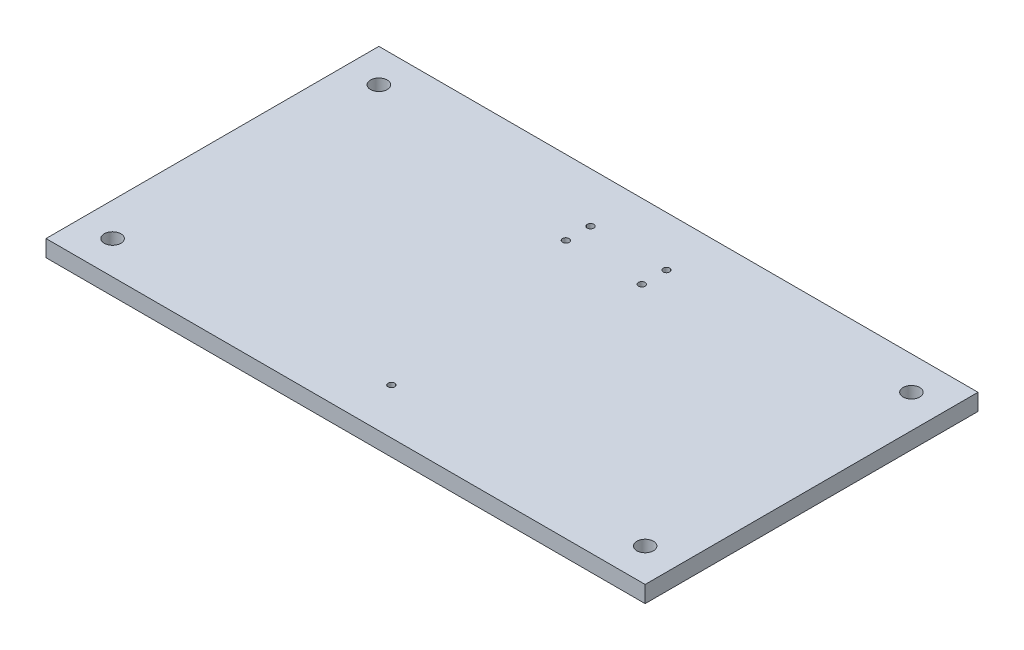
from build123d import *

# Parameters (mm, degrees)
SKETCH1_W           = 228.6
SKETCH1_H           = 127
SKETCH1_R           = 1.27
SKETCH1_R_2         = 3.175
BOSS_EXTRUDE1_DEPTH = 6.35


with BuildPart() as part:
    # Sketch1 → Boss-Extrude1 (new body)
    with BuildSketch(Plane(origin=(0, 0, 0), x_dir=(1, 0, 0), z_dir=(0, 1, 0))):
        with Locations((76.2, -6.35)):
            Rectangle(SKETCH1_W, SKETCH1_H)
        with Locations(Location((61.71311, 38.1, 0), (0, 0, 270))):
            Circle(SKETCH1_R, mode=Mode.SUBTRACT)
        with Locations(Location((90.68689, 38.1, 0), (0, 0, 270))):
            Circle(SKETCH1_R, mode=Mode.SUBTRACT)
        with Locations(Location((76.2, -52.35956, 0), (0, 0, 270))):
            Circle(SKETCH1_R, mode=Mode.SUBTRACT)
        with Locations(Location((61.71311, 28.69946, 0), (0, 0, 270))):
            Circle(SKETCH1_R, mode=Mode.SUBTRACT)
        with Locations(Location((90.68689, 28.69946, 0), (0, 0, 270))):
            Circle(SKETCH1_R, mode=Mode.SUBTRACT)
        with Locations(Location((-25.4, 44.45, 0), (0, 0, 270))):
            Circle(SKETCH1_R_2, mode=Mode.SUBTRACT)
        with Locations(Location((177.8, 44.45, 0), (0, 0, 270))):
            Circle(SKETCH1_R_2, mode=Mode.SUBTRACT)
        with Locations(Location((177.8, -57.15, 0), (0, 0, 270))):
            Circle(SKETCH1_R_2, mode=Mode.SUBTRACT)
        with Locations(Location((-25.4, -57.15, 0), (0, 0, 270))):
            Circle(SKETCH1_R_2, mode=Mode.SUBTRACT)
    extrude(amount=BOSS_EXTRUDE1_DEPTH)


solid = part.part
